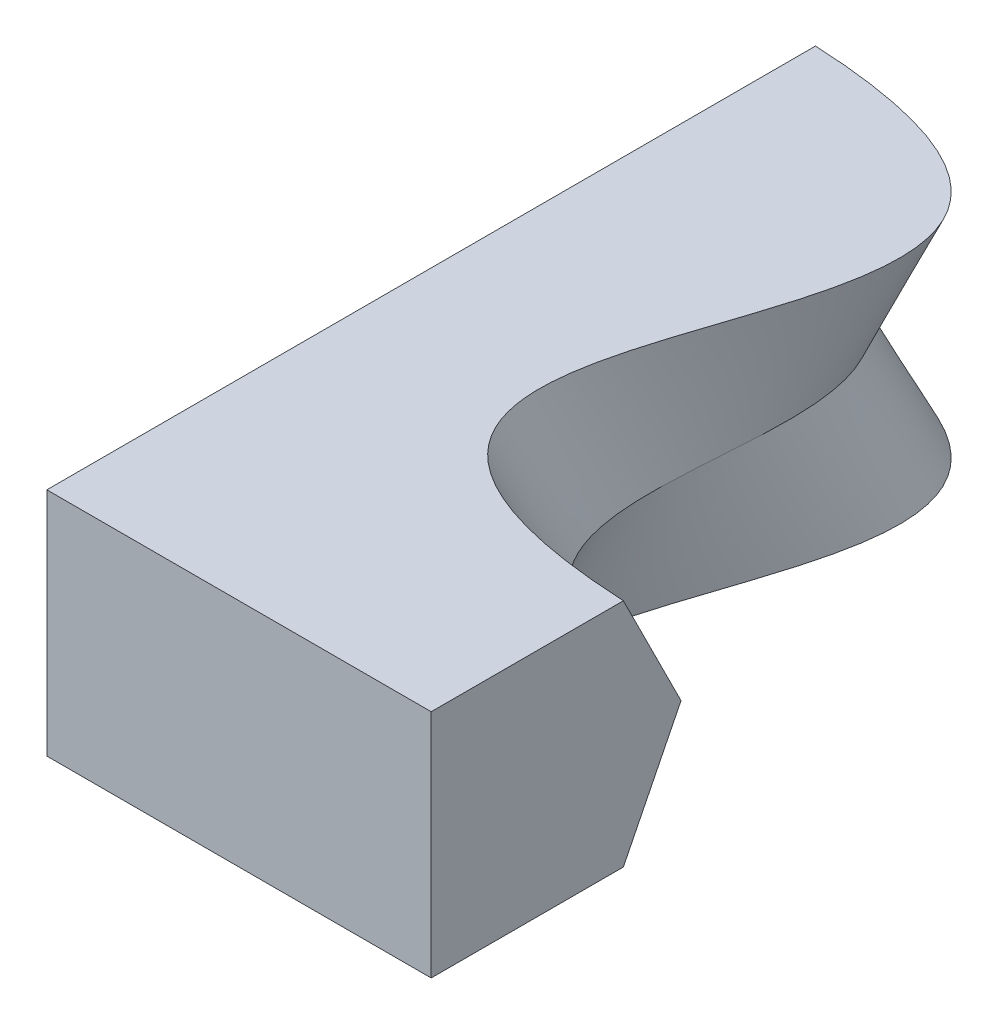
from build123d import *


with BuildPart() as part:
    # Sketch1 → Loft1 section 0
    with BuildSketch(Plane(origin=(0, 0, 0), x_dir=(1, 0, 0), z_dir=(0, 1, 0))):
        with BuildLine():
            Line((0, 0), (2, 0))
            Line((2, 0), (2, 1))
            add(Edge.make_bspline(
                [(0, 4), (2.939621294, 3.853681673), (-0.939621294, 1.146318327), (2, 1)],
                knots=[0, 0, 0, 0, 1, 1, 1, 1], degree=3))
            Line((0, 4), (0, 0))
        make_face()
    # Sketch2 → Loft1 section 1
    with BuildSketch(Plane(origin=(0, 0.6, 0), x_dir=(1, 0, 0), z_dir=(0, 1, 0))):
        with BuildLine():
            Line((0, 0), (2, 0))
            Line((2, 0), (2, 1.3))
            add(Edge.make_bspline(
                [(0, 3.7), (2.166666667, 3.7), (-0.166666667, 1.3), (2, 1.3)],
                knots=[0, 0, 0, 0, 1, 1, 1, 1], degree=3))
            Line((0, 3.7), (0, 0))
        make_face()
    loft1 = loft()

    # Mirror1: Loft1 across plane
    add(loft1.mirror(Plane.ZX.offset(0.6)))


solid = part.part
